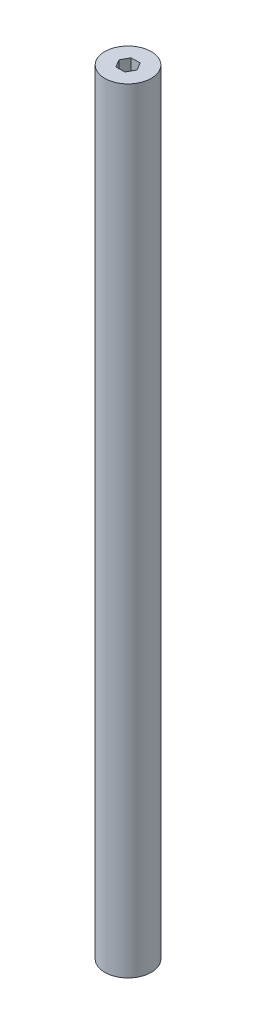
from build123d import *

# Parameters (mm, degrees)
SKETCH1_R           = 19.05
BOSS_EXTRUDE1_DEPTH = 635


with BuildPart() as part:
    # Sketch1 → Boss-Extrude1 (new body)
    with BuildSketch(Plane(origin=(0, 0, 0), x_dir=(1, 0, 0), z_dir=(0, 1, 0))):
        with Locations(Location((0, 0, 0), (0, 0, 90))):
            Circle(SKETCH1_R)
        Polygon((3.770516125, -6.288604096), (7.331348965, 0.121060702), (3.560832839, 6.409664798), (-3.770516125, 6.288604096), (-7.331348965, -0.121060702), (-3.560832839, -6.409664798), align=None, mode=Mode.SUBTRACT)
    extrude(amount=BOSS_EXTRUDE1_DEPTH)


solid = part.part
